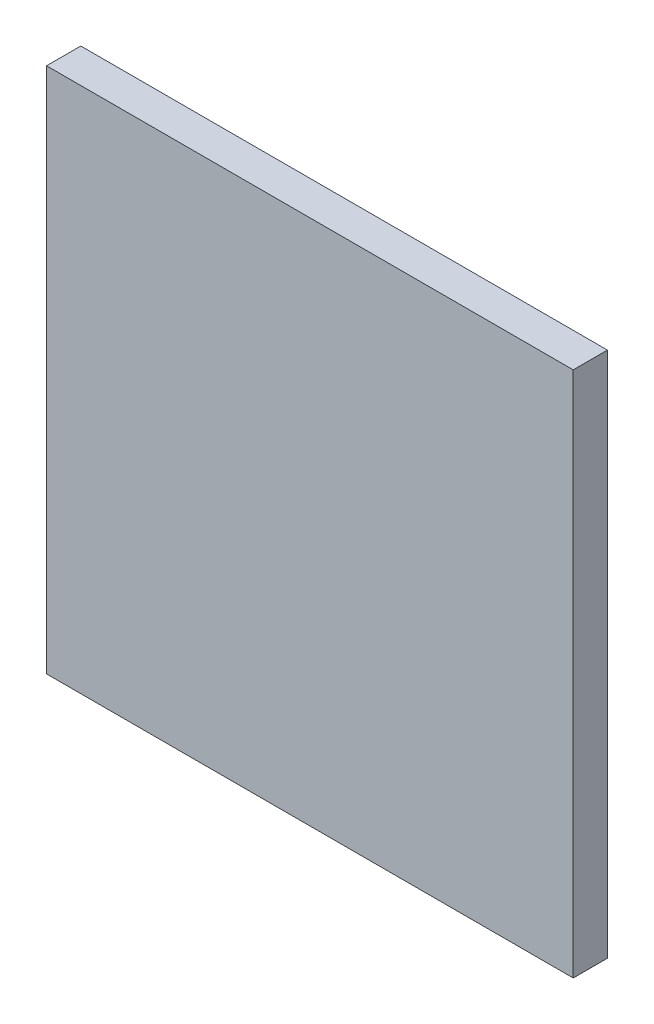
from build123d import *

# Parameters (mm, degrees)
SKETCH2_W           = 10
SKETCH2_H           = 10
BOSS_EXTRUDE1_DEPTH = 0.65


with BuildPart() as part:
    # Sketch2 → Boss-Extrude1 (new body)
    with BuildSketch(Plane.XY):
        with Locations((-5, -5)):
            Rectangle(SKETCH2_W, SKETCH2_H)
    extrude(amount=BOSS_EXTRUDE1_DEPTH)


solid = part.part
